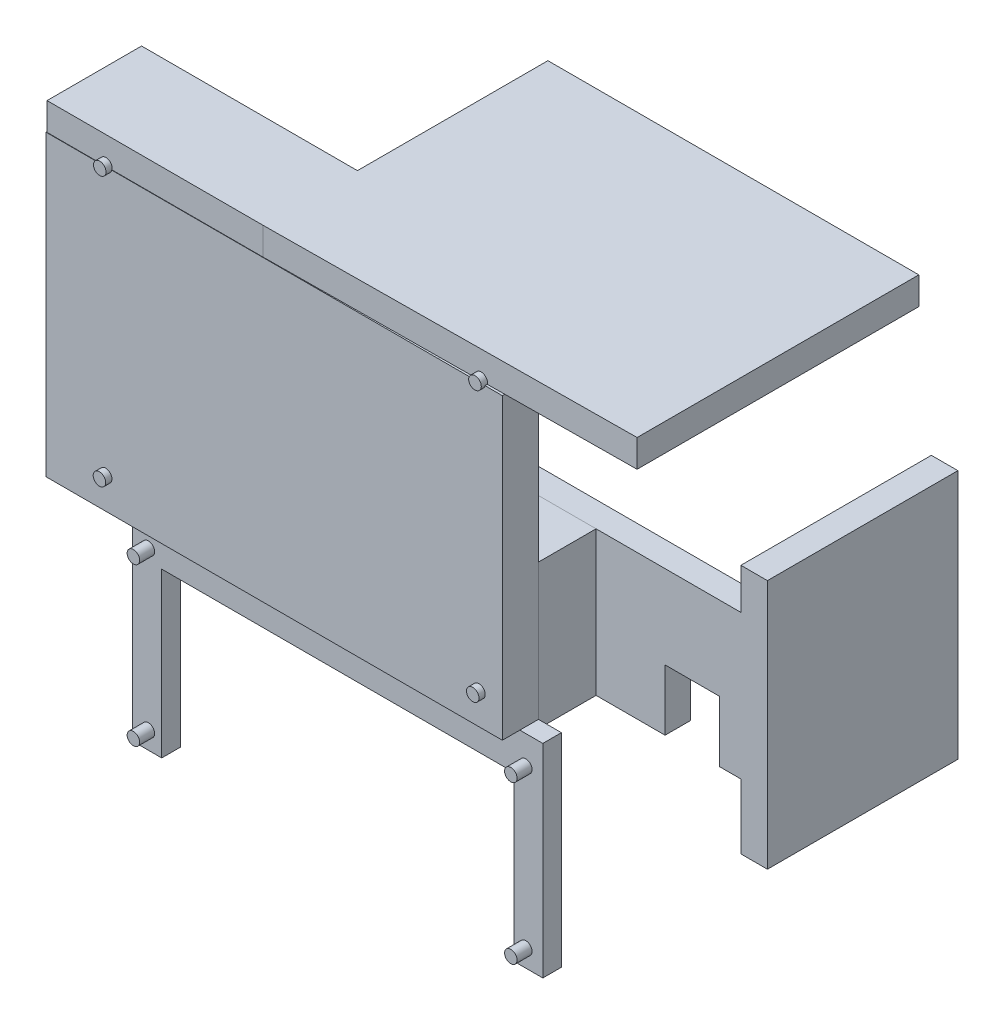
from build123d import *

# Parameters (mm, degrees)
SKETCH2_W             = 74.20112143
SKETCH2_H             = 5.509329328
BOSS_EXTRUDE1_DEPTH   = 31.75
SKETCH2_W_2           = 5.306940646
SKETCH2_H_2           = 50.003346063
BOSS_EXTRUDE1_2_DEPTH = 31.75
SKETCH3_W             = 74.20112143
SKETCH3_H             = 5.509329328
SKETCH3_W_2           = 5.306940646
SKETCH3_H_2           = 50.003346063
BOSS_EXTRUDE2_DEPTH   = 6.35
SKETCH4_W             = 5.051549335
SKETCH4_H             = 28.862745674
BOSS_EXTRUDE3_DEPTH   = 124.46
SKETCH5_W             = 5.001212889
SKETCH5_H             = 28.862745674
BOSS_EXTRUDE4_DEPTH   = 26.67
BOSS_EXTRUDE7_REACH   = 1075.465
SKETCH9_W             = 74.20112143
SKETCH9_H             = 5.509329328
SKETCH11_W            = 119.769071802
SKETCH11_H            = 7.221051578
BOSS_EXTRUDE8_DEPTH   = 59.69
SKETCH12_W            = 18.906782183
SKETCH12_H            = 5.509329328
BOSS_EXTRUDE9_DEPTH   = 43.18
SKETCH13_R            = 1.25
BOSS_EXTRUDE10_DEPTH  = 1.25
SKETCH14_R            = 1.25
BOSS_EXTRUDE11_DEPTH  = 1.25
SKETCH15_R            = 1.25
BOSS_EXTRUDE12_DEPTH  = 1.25
SKETCH17_W            = 28.508394359
SKETCH17_H            = 59.69
CUT_EXTRUDE1_DEPTH    = 7.62
SKETCH18_W            = 10.932918465
SKETCH18_H            = 12.187050208
CUT_EXTRUDE2_DEPTH    = 7.62
BOSS_EXTRUDE13_DEPTH  = 40.64
SKETCH21_W            = 70.492813389
SKETCH21_H            = 32.719224038
CUT_EXTRUDE3_DEPTH    = 12.7
SKETCH22_R            = 1.25
BOSS_EXTRUDE14_DEPTH  = 3
BOSS_EXTRUDE15_REACH  = 1075.947
SKETCH24_W            = 37.273805704
SKETCH24_H            = 28.862745674
BOSS_EXTRUDE16_REACH  = 1075.947
SKETCH25_W            = 31.370714304
SKETCH25_H            = 28.862745674


with BuildPart() as part:
    # Sketch2 → Boss-Extrude1 (new body)
    with BuildSketch(Plane.XY.offset(1338.373843603)):
        with Locations((504.759181332, 918.515687133)):
            Rectangle(SKETCH2_W, SKETCH2_H)
    extrude(amount=BOSS_EXTRUDE1_DEPTH)



with BuildPart() as body_2:
    # Sketch2 → Boss-Extrude1 2 (new body)
    with BuildSketch(Plane.XY.offset(1338.373843603)):
        with Locations((547.015879906, 866.253246095)):
            Rectangle(SKETCH2_W_2, SKETCH2_H_2)
    extrude(amount=BOSS_EXTRUDE1_2_DEPTH)


with BuildPart() as part_1:
    add(part.part)

    add(body_2.part)  # Boss-Extrude2 merges body 2
    # Sketch3 → Boss-Extrude2 (add)
    with BuildSketch(Plane(origin=(0, 0, 1338.373843603), x_dir=(-1, 0, 0), z_dir=(0, 0, -1))):
        with Locations((-504.759181332, 918.515687133)):
            Rectangle(SKETCH3_W, SKETCH3_H)
        with Locations((-547.015879906, 866.253246095)):
            Rectangle(SKETCH3_W_2, SKETCH3_H_2)
    extrude(amount=BOSS_EXTRUDE2_DEPTH)

    # Sketch4 → Boss-Extrude3 (add)
    with BuildSketch(Plane.ZY.offset(-544.362409583)):
        with Locations((1367.598068936, 868.663439861)):
            Rectangle(SKETCH4_W, SKETCH4_H)
    extrude(amount=BOSS_EXTRUDE3_DEPTH)

    # Sketch5 → Boss-Extrude4 (add)
    with BuildSketch(Plane(origin=(0, 0, 1365.072294268), x_dir=(-1, 0, 0), z_dir=(0, 0, -1))):
        with Locations((-422.403016028, 868.663439861)):
            Rectangle(SKETCH5_W, SKETCH5_H)
    extrude(amount=BOSS_EXTRUDE4_DEPTH)



with BuildPart() as body_2_2:
    # Boss-Extrude7: up to this plane
    boss_extrude7_end = Plane(origin=(483.853693238, 889.164381922, 1388.889293529), z_dir=(0.008726535498373836, 0, 0.9999619230641713))
    # Sketch9 → Boss-Extrude7 (new, up to the surface)
    with BuildSketch(Plane.XY.offset(1370.123843603), mode=Mode.PRIVATE) as boss_extrude7_sk1:
        with Locations((504.759181332, 918.515687133)):
            Rectangle(SKETCH9_W, SKETCH9_H)
    boss_extrude7_tool1 = split(extrude(boss_extrude7_sk1.sketch, amount=BOSS_EXTRUDE7_REACH, mode=Mode.PRIVATE), bisect_by=boss_extrude7_end, keep=Keep.BOTH, mode=Mode.PRIVATE)
    add(boss_extrude7_tool1.solids().sort_by_distance((504.759181, 918.515687, 1370.123844))[0])

    # Sketch11 → Boss-Extrude8 (add)
    with BuildSketch(Plane.XZ.offset(-915.761022469)):
        with Locations((484.251561922, 1385.494960895)):
            Rectangle(SKETCH11_W, SKETCH11_H)
    extrude(amount=BOSS_EXTRUDE8_DEPTH)


with BuildPart() as part_2:
    add(part_1.part)

    add(body_2_2.part)  # Boss-Extrude9 merges body 2 2
    # Sketch12 → Boss-Extrude9 (add)
    with BuildSketch(Plane.ZY.offset(-467.658620617)):
        with Locations((1379.577234695, 918.515687133)):
            Rectangle(SKETCH12_W, SKETCH12_H)
    extrude(amount=BOSS_EXTRUDE9_DEPTH)

    # Sketch13 → Boss-Extrude10 (add)
    with BuildSketch(Plane.XY.offset(1389.105486684)):
        with Locations(Location((436.283580196, 862.279381922, 0), (0, 0, 180))):
            Circle(SKETCH13_R)
        with Locations(Location((510.952736915, 862.279381922, 0), (0, 0, 180))):
            Circle(SKETCH13_R)
    extrude(amount=BOSS_EXTRUDE10_DEPTH)

    # Sketch14 → Boss-Extrude11 (add)
    with BuildSketch(Plane.XY.offset(1389.030625786)):
        with Locations(Location((436.269505167, 916.049381922, 0), (0, 0, 193.337554782))):
            Circle(SKETCH14_R)
    extrude(amount=BOSS_EXTRUDE11_DEPTH)

    # Sketch15 → Boss-Extrude12 (add)
    with BuildSketch(Plane(origin=(12.156576854, 0, 1393.005731901), x_dir=(0.9999619230641713, 0, -0.008726535498373836), z_dir=(0.008726535498373836, 0, 0.9999619230641713))):
        with Locations(Location((498.801077848, 916.049381922, 0), (0, 0, 193.337554782))):
            Circle(SKETCH15_R)
    extrude(amount=BOSS_EXTRUDE12_DEPTH)

    # Sketch17 → Cut-Extrude1 (cut)
    with BuildSketch(Plane.XY.offset(1389.105486684)):
        with Locations((529.881900643, 885.916022469)):
            Rectangle(SKETCH17_W, SKETCH17_H)
    extrude(amount=-CUT_EXTRUDE1_DEPTH, mode=Mode.SUBTRACT)

    # Sketch18 → Cut-Extrude2 (cut)
    with BuildSketch(Plane.XY.offset(1370.123843603)):
        with Locations((534.664039293, 860.325592128)):
            Rectangle(SKETCH18_W, SKETCH18_H)
    extrude(amount=-CUT_EXTRUDE2_DEPTH, mode=Mode.SUBTRACT)

    # Sketch20 → Boss-Extrude13 (add)
    with BuildSketch(Plane.XZ.offset(-856.071022469)):
        Polygon((515.627703464, 1385.604979593), (520.22442703, 1385.604979593), (520.22442703, 1381.884435106), (515.627703464, 1381.884435106), (438.143953154, 1381.884435106), (438.143953154, 1385.604979593), align=None)
    extrude(amount=BOSS_EXTRUDE13_DEPTH)

    # Sketch21 → Cut-Extrude3 (cut)
    with BuildSketch(Plane.XY.offset(1385.604979593)):
        with Locations((479.240417437, 831.790634488)):
            Rectangle(SKETCH21_W, SKETCH21_H)
    extrude(amount=-CUT_EXTRUDE3_DEPTH, mode=Mode.SUBTRACT)

    # Sketch22 → Boss-Extrude14 (add)
    with BuildSketch(Plane.XY.offset(1385.604979593)):
        with Locations(Location((516.824440929, 850.453733138, 0), (0, 0, 180))):
            Circle(SKETCH22_R)
        with Locations(Location((516.824440929, 818.953733138, 0), (0, 0, 180))):
            Circle(SKETCH22_R)
        with Locations(Location((441.324440929, 850.453733138, 0), (0, 0, 180))):
            Circle(SKETCH22_R)
        with Locations(Location((441.324440929, 818.953733138, 0), (0, 0, 180))):
            Circle(SKETCH22_R)
    extrude(amount=BOSS_EXTRUDE14_DEPTH)


with BuildPart() as body_2_3:

    # Sketch24 → Boss-Extrude15 (new, up to next)
    with BuildSketch(Plane(origin=(0, 0, 1381.884435106), x_dir=(-1, 0, 0), z_dir=(0, 0, -1)), mode=Mode.PRIVATE) as boss_extrude15_sk1:
        with Locations((-496.762080789, 868.663439861)):
            Rectangle(SKETCH24_W, SKETCH24_H)
    boss_extrude15_tool1 = extrude(boss_extrude15_sk1.sketch, amount=BOSS_EXTRUDE15_REACH, mode=Mode.PRIVATE) - part_2.part
    add(boss_extrude15_tool1.solids().sort_by_distance((496.762081, 868.66344, 1381.884435))[0])


with BuildPart() as part_3:
    add(part_2.part)

    # Sketch25 → Boss-Extrude16 (add, up to next)
    with BuildSketch(Plane(origin=(0, 0, 1381.884435106), x_dir=(-1, 0, 0), z_dir=(0, 0, -1)), mode=Mode.PRIVATE) as boss_extrude16_sk1:
        with Locations((-443.549928301, 868.663439861)):
            Rectangle(SKETCH25_W, SKETCH25_H)
    boss_extrude16_tool1 = extrude(boss_extrude16_sk1.sketch, amount=BOSS_EXTRUDE16_REACH, mode=Mode.PRIVATE) - part_3.part
    add(boss_extrude16_tool1.solids().sort_by_distance((443.549928, 868.66344, 1381.884435))[0])


solid = Compound([body_2_3.part, part_3.part])
